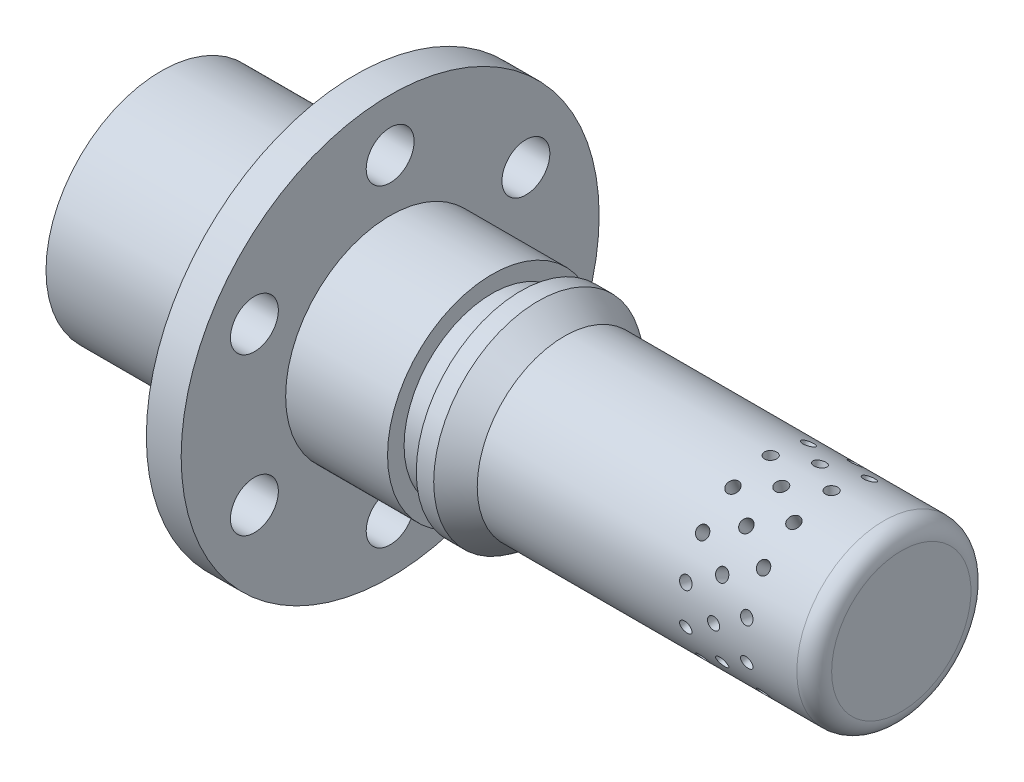
from build123d import *

# Parameters (mm, degrees)
CUT_EXTRUDE1_REACH = 96.641
SKETCH2_R          = 0.7
SKETCH15_R         = 0.7
CUT_EXTRUDE3_DEPTH = 92.525952604
CIRPATTERN1_COUNT  = 14
CUT_EXTRUDE2_REACH = 73.297
SKETCH3_R          = 2.75
CIRPATTERN2_COUNT  = 6


with BuildPart() as part:
    # Sketch1 → Revolve1 (revolve)
    with BuildSketch(Plane.XY):
        with BuildLine():
            Line((0, 13.2205), (21.3, 13.2205))
            ThreePointArc((21.3, 13.2205), (22.007106781, 13.513393219), (22.3, 14.2205))
            Line((22.3, 14.2205), (22.3, 24))
            Line((22.3, 24), (26.3, 24))
            Line((26.3, 24), (26.3, 12))
            Line((26.3, 12), (38, 12))
            Line((38, 12), (38, 10.1))
            Line((38, 10.1), (41.3, 10.1))
            Line((41.3, 10.1), (41.3, 12))
            Line((41.3, 12), (43.3, 12))
            Line((43.3, 12), (46.3, 10))
            Line((46.3, 10), (83, 10))
            ThreePointArc((83, 10), (84.414213562, 9.414213562), (85, 8))
            Line((85, 8), (85, 0))
            Line((85, 0), (83, 0))
            Line((83, 0), (78.381197846, 8))
            Line((78.381197846, 8), (0, 8))
            Line((0, 8), (0, 13.2205))
        make_face()
    revolve(axis=Axis((0, 0, 0), (1, 0, 0)))

    # Sketch2 → Cut-Extrude1 (cut, up to next)
    with BuildSketch(Plane(origin=(0, 10, 0), x_dir=(1, 0, 0), z_dir=(0, 1, 0)), mode=Mode.PRIVATE) as cut_extrude1_sk1:
        with Locations((77, 0)):
            Circle(SKETCH2_R)
    cut_extrude1_tool1 = extrude(cut_extrude1_sk1.sketch, amount=-CUT_EXTRUDE1_REACH, mode=Mode.PRIVATE) & part.part
    # Sketch2 → Cut-Extrude1 (cut, up to next)
    with BuildSketch(Plane(origin=(0, 10, 0), x_dir=(1, 0, 0), z_dir=(0, 1, 0)), mode=Mode.PRIVATE) as cut_extrude1_sk2:
        with Locations((70, 0)):
            Circle(SKETCH2_R)
    cut_extrude1_tool2 = extrude(cut_extrude1_sk2.sketch, amount=-CUT_EXTRUDE1_REACH, mode=Mode.PRIVATE) & part.part
    cut_extrude1_1 = cut_extrude1_tool1.solids().sort_by_distance((77, 10, 0))[0]
    add(cut_extrude1_1, mode=Mode.SUBTRACT)
    cut_extrude1_2 = cut_extrude1_tool2.solids().sort_by_distance((70, 10, 0))[0]
    add(cut_extrude1_2, mode=Mode.SUBTRACT)
    cut_extrude1 = cut_extrude1_1 + cut_extrude1_2  # Cut-Extrude1 as one shape, for the pattern or mirror that repeats it

    # Sketch15 → Cut-Extrude3 (cut, through all)
    with BuildSketch(Plane.XY):
        with Locations((73.437108541, 0)):
            Circle(SKETCH15_R)
    cut_extrude3 = extrude(amount=-CUT_EXTRUDE3_DEPTH, mode=Mode.SUBTRACT)

    # CirPattern1: Cut-Extrude1, Cut-Extrude3 ×14 about axis
    cirpattern1_axis = Axis((83, 0, 0), (-1, 0, 0))
    add([cut_extrude1.rotate(cirpattern1_axis, i * 360 / CIRPATTERN1_COUNT) for i in range(1, CIRPATTERN1_COUNT)], mode=Mode.SUBTRACT)
    add([cut_extrude3.rotate(cirpattern1_axis, i * 360 / CIRPATTERN1_COUNT) for i in range(1, CIRPATTERN1_COUNT)], mode=Mode.SUBTRACT)

    # Sketch3 → Cut-Extrude2 (cut, up to next)
    with BuildSketch(Plane.ZY.offset(-22.3), mode=Mode.PRIVATE) as cut_extrude2_sk1:
        with Locations((0, 18)):
            Circle(SKETCH3_R)
    cut_extrude2_tool1 = extrude(cut_extrude2_sk1.sketch, amount=-CUT_EXTRUDE2_REACH, mode=Mode.PRIVATE) & part.part
    cut_extrude2 = cut_extrude2_tool1.solids().sort_by_distance((22.3, 18, 0))[0]
    add(cut_extrude2, mode=Mode.SUBTRACT)

    # CirPattern2: Cut-Extrude2 ×6 about axis
    cirpattern2_axis = Axis((0, 0, 0), (-1, 0, 0))
    for i in range(1, CIRPATTERN2_COUNT):
        add(cut_extrude2.rotate(cirpattern2_axis, i * 360 / CIRPATTERN2_COUNT), mode=Mode.SUBTRACT)


solid = part.part
